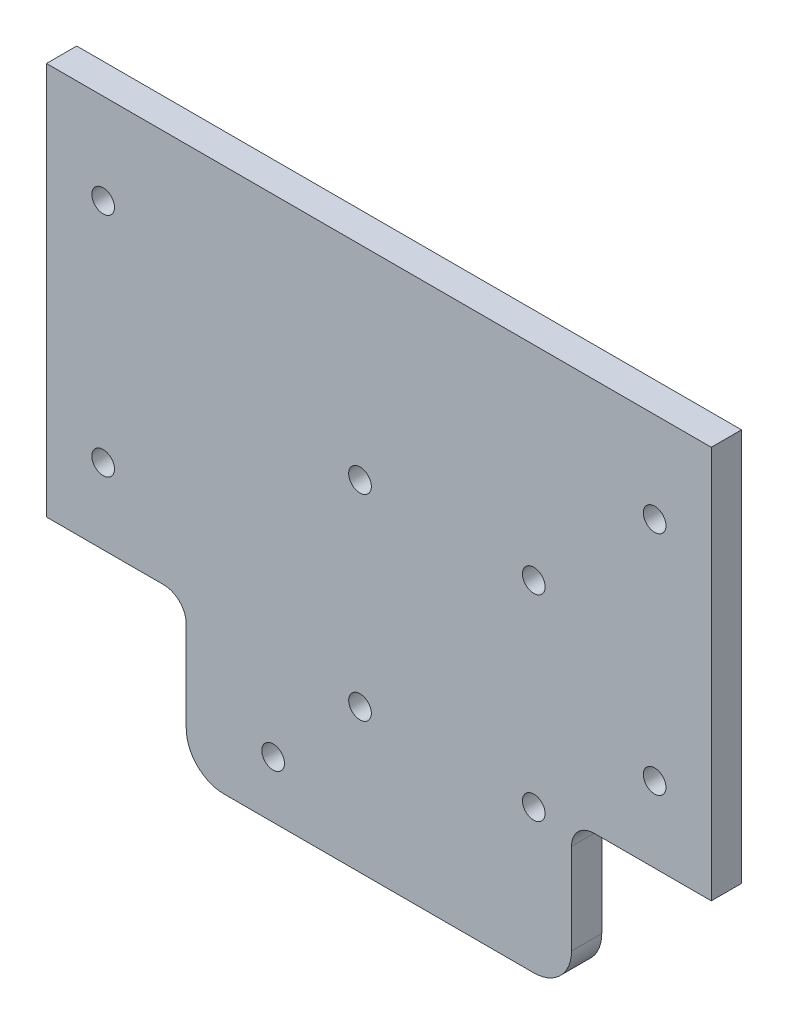
from build123d import *

# Parameters (mm, degrees)
SKETCH_1_W          = 88
SKETCH_1_H          = 72
EXTRUDE_1_DEPTH     = 4
SKETCH_2_W          = 18.5
SKETCH_2_H          = 20
CUT_EXTRUDE_1_DEPTH = 114.771701227
FILLET_1_R          = 3
SKETCH_3_W          = 18.5
SKETCH_3_H          = 20
CUT_EXTRUDE_2_DEPTH = 114.771701227
FILLET_2_R          = 3
SKETCH_5_R          = 1.5
CUT_EXTRUDE_4_DEPTH = 114.771701227
SKETCH_4_R          = 1.5
CUT_EXTRUDE_3_DEPTH = 114.771701227
FILLET_4_R          = 5


with BuildPart() as part:
    # 草图1 → 凸台-拉伸1 (new body)
    with BuildSketch(Plane.XY):
        with Locations((44, 36)):
            Rectangle(SKETCH_1_W, SKETCH_1_H)
    extrude(amount=EXTRUDE_1_DEPTH)

    # 草图2 → 切除-拉伸1 (cut, through all)
    with BuildSketch(Plane.XY.offset(4)):
        with Locations((9.25, 10)):
            Rectangle(SKETCH_2_W, SKETCH_2_H)
    extrude(amount=-CUT_EXTRUDE_1_DEPTH, mode=Mode.SUBTRACT)

    # 圆角1
    fillet_1_edges = [part.edges().sort_by_distance(p)[0] for p in [
        (18.5, 20, 2),
    ]]
    fillet(fillet_1_edges, radius=FILLET_1_R)

    # 草图3 → 切除-拉伸2 (cut, through all)
    with BuildSketch(Plane.XY.offset(4)):
        with Locations((78.75, 10)):
            Rectangle(SKETCH_3_W, SKETCH_3_H)
    extrude(amount=-CUT_EXTRUDE_2_DEPTH, mode=Mode.SUBTRACT)

    # 圆角2
    fillet_2_edges = [part.edges().sort_by_distance(p)[0] for p in [
        (69.5, 20, 2),
    ]]
    fillet(fillet_2_edges, radius=FILLET_2_R)

    # 草图5 → 切除-拉伸4 (cut, through all)
    with BuildSketch(Plane.XY.offset(4)):
        with Locations((80.5, 60)):
            Circle(SKETCH_5_R)
        with Locations((80.5, 30)):
            Circle(SKETCH_5_R)
        with Locations(Location((30, 7.5, 0), (0, 0, 180))):
            Circle(SKETCH_5_R)
        with Locations(Location((7.5, 30, 0), (0, 0, 180))):
            Circle(SKETCH_5_R)
        with Locations(Location((7.5, 60, 0), (0, 0, 180))):
            Circle(SKETCH_5_R)
    extrude(amount=-CUT_EXTRUDE_4_DEPTH, mode=Mode.SUBTRACT)

    # 草图4 → 切除-拉伸3 (cut, through all)
    with BuildSketch(Plane.XY.offset(4)):
        with Locations((41.5, 45)):
            Circle(SKETCH_4_R)
        with Locations((64.5, 45)):
            Circle(SKETCH_4_R)
        with Locations((64.5, 19)):
            Circle(SKETCH_4_R)
        with Locations((41.5, 19)):
            Circle(SKETCH_4_R)
    extrude(amount=-CUT_EXTRUDE_3_DEPTH, mode=Mode.SUBTRACT)

    # 圆角4
    fillet_4_edges = [part.edges().sort_by_distance(p)[0] for p in [
        (18.5, 0, 2),
        (69.5, 0, 2),
    ]]
    fillet(fillet_4_edges, radius=FILLET_4_R)


solid = part.part
